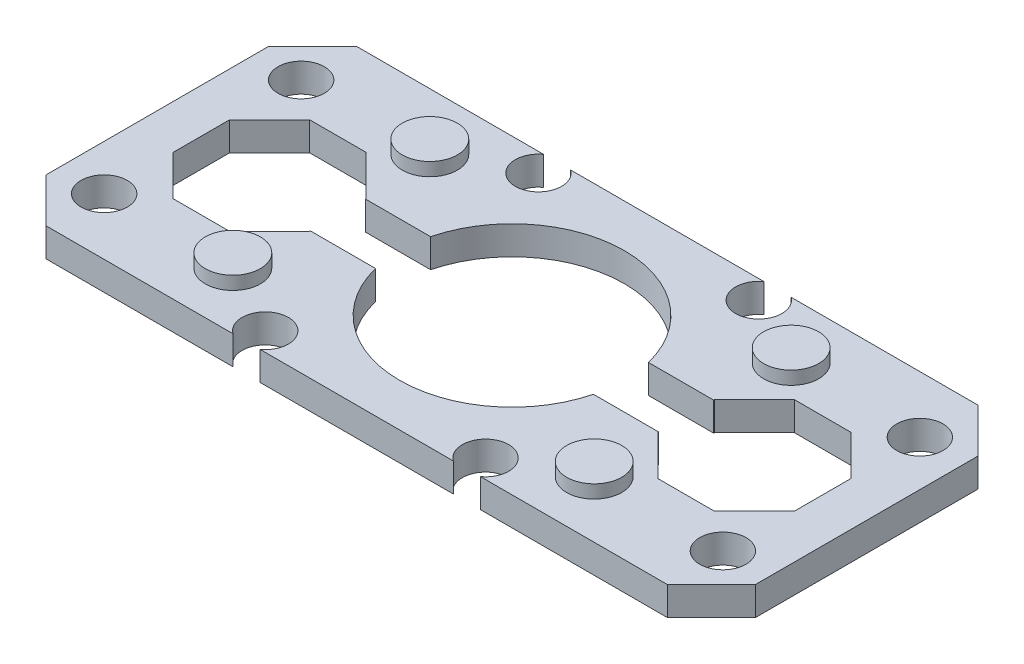
from build123d import *

# Parameters (mm, degrees)
SKETCH1_R           = 1.3335
SKETCH1_R_2         = 1.5875
BOSS_EXTRUDE1_DEPTH = 1.651
CHAMFER1_SIZE       = 2.54
SKETCH1_2_R         = 1.5875
BOSS_EXTRUDE2_DEPTH = 2.413
SKETCH1_3_R         = 1.5875
CUT_EXTRUDE1_DEPTH  = 0.889
CUT_EXTRUDE2_DEPTH  = 23.382376376


with BuildPart() as part:
    # Sketch1 → Boss-Extrude1 (new body)
    with BuildSketch(Plane(origin=(0, 0, 0), x_dir=(1, 0, 0), z_dir=(0, 1, 0))):
        with BuildLine():
            Line((-5.567119422, 8.9535), (5.567119422, 8.9535))
            ThreePointArc((5.567119422, 8.9535), (6.35, 6.5405), (7.132880578, 8.9535))
            Line((7.132880578, 8.9535), (20.447, 8.9535))
            Line((20.447, 8.9535), (20.447, -8.9535))
            Line((20.447, -8.9535), (7.132880578, -8.9535))
            ThreePointArc((7.132880578, -8.9535), (6.35, -6.5405), (5.567119422, -8.9535))
            Line((5.567119422, -8.9535), (-5.567119422, -8.9535))
            ThreePointArc((-5.567119422, -8.9535), (-6.35, -6.5405), (-7.132880578, -8.9535))
            Line((-7.132880578, -8.9535), (-20.447, -8.9535))
            Line((-20.447, -8.9535), (-20.447, 8.9535))
            Line((-20.447, 8.9535), (-7.132880578, 8.9535))
            ThreePointArc((-7.132880578, 8.9535), (-6.35, 6.5405), (-5.567119422, 8.9535))
        make_face()
        with Locations((-17.8308, 5.6769)):
            Circle(SKETCH1_R, mode=Mode.SUBTRACT)
        with Locations((17.8308, 5.6769)):
            Circle(SKETCH1_R, mode=Mode.SUBTRACT)
        with Locations((17.8308, -5.6769)):
            Circle(SKETCH1_R, mode=Mode.SUBTRACT)
        with Locations((-17.8308, -5.6769)):
            Circle(SKETCH1_R, mode=Mode.SUBTRACT)
        with Locations((-10.414, 5.6769)):
            Circle(SKETCH1_R_2, mode=Mode.SUBTRACT)
        with Locations((10.414, 5.6769)):
            Circle(SKETCH1_R_2, mode=Mode.SUBTRACT)
        with Locations((10.414, -5.6769)):
            Circle(SKETCH1_R_2, mode=Mode.SUBTRACT)
        with Locations((-10.414, -5.6769)):
            Circle(SKETCH1_R_2, mode=Mode.SUBTRACT)
    extrude(amount=BOSS_EXTRUDE1_DEPTH)

    # Chamfer1
    chamfer1_edges = [part.edges().sort_by_distance(p)[0] for p in [
        (-20.447, 0.8255, 8.9535),
        (-20.447, 0.8255, -8.9535),
        (20.447, 0.8255, -8.9535),
        (20.447, 0.8255, 8.9535),
    ]]
    chamfer(chamfer1_edges, length=CHAMFER1_SIZE)

    # Sketch1<2> → Boss-Extrude2 (add)
    with BuildSketch(Plane(origin=(0, 0, 0), x_dir=(1, 0, 0), z_dir=(0, 1, 0))):
        with Locations((-10.414, 5.6769)):
            Circle(SKETCH1_2_R)
        with Locations((10.414, 5.6769)):
            Circle(SKETCH1_2_R)
        with Locations((10.414, -5.6769)):
            Circle(SKETCH1_2_R)
        with Locations((-10.414, -5.6769)):
            Circle(SKETCH1_2_R)
    extrude(amount=BOSS_EXTRUDE2_DEPTH)

    # Sketch1<3> → Cut-Extrude1 (cut)
    with BuildSketch(Plane(origin=(0, 0, 0), x_dir=(1, 0, 0), z_dir=(0, 1, 0))):
        with Locations((-10.414, 5.6769)):
            Circle(SKETCH1_3_R)
        with Locations((10.414, 5.6769)):
            Circle(SKETCH1_3_R)
        with Locations((10.414, -5.6769)):
            Circle(SKETCH1_3_R)
        with Locations((-10.414, -5.6769)):
            Circle(SKETCH1_3_R)
    extrude(amount=CUT_EXTRUDE1_DEPTH, mode=Mode.SUBTRACT)

    # Sketch2 → Cut-Extrude2 (cut, through all)
    with BuildSketch(Plane(origin=(0, 1.651, 0), x_dir=(1, 0, 0), z_dir=(0, 1, 0))):
        with BuildLine():
            Line((-10.033, 1.5875), (-10.033, 1.630758795))
            Line((-10.033, 1.630758795), (-12.339241205, 3.937))
            Line((-12.339241205, 3.937), (-15.600758795, 3.937))
            Line((-15.600758795, 3.937), (-17.907, 1.630758795))
            Line((-17.907, 1.630758795), (-17.907, -1.630758795))
            Line((-17.907, -1.630758795), (-15.600758795, -3.937))
            Line((-15.600758795, -3.937), (-12.339241205, -3.937))
            Line((-12.339241205, -3.937), (-10.033, -1.630758795))
            Line((-10.033, -1.630758795), (-10.033, -1.5875))
            Line((-10.033, -1.5875), (-6.279440481, -1.5875))
            ThreePointArc((-6.279440481, -1.5875), (0, -6.477), (6.279440481, -1.5875))
            Line((6.279440481, -1.5875), (10.033, -1.5875))
            Line((10.033, -1.5875), (10.033, -1.630758795))
            Line((10.033, -1.630758795), (12.339241205, -3.937))
            Line((12.339241205, -3.937), (15.600758795, -3.937))
            Line((15.600758795, -3.937), (17.907, -1.630758795))
            Line((17.907, -1.630758795), (17.907, 1.630758795))
            Line((17.907, 1.630758795), (15.600758795, 3.937))
            Line((15.600758795, 3.937), (12.339241205, 3.937))
            Line((12.339241205, 3.937), (10.033, 1.630758795))
            Line((10.033, 1.630758795), (10.033, 1.5875))
            Line((10.033, 1.5875), (6.279440481, 1.5875))
            ThreePointArc((6.279440481, 1.5875), (0, 6.477), (-6.279440481, 1.5875))
            Line((-6.279440481, 1.5875), (-10.033, 1.5875))
        make_face()
    extrude(amount=-CUT_EXTRUDE2_DEPTH, mode=Mode.SUBTRACT)


solid = part.part
